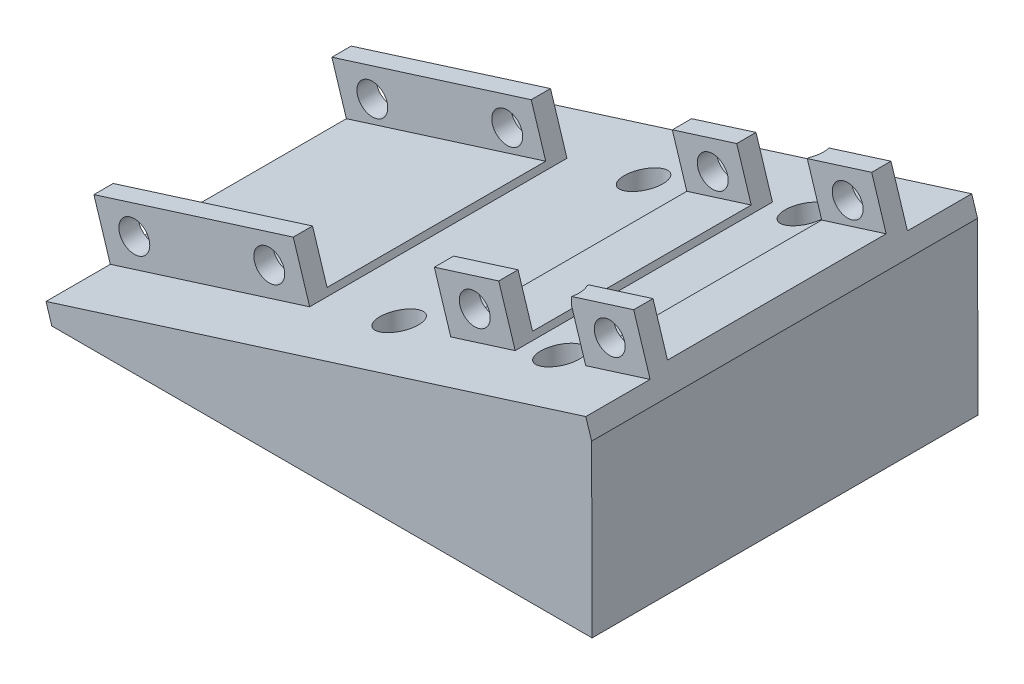
from build123d import *

# Parameters (mm, degrees)
EXTRUDE_1_DEPTH     = 60
SKETCH_2_W          = 32.5
SKETCH_2_H          = 3
EXTRUDE_2_DEPTH     = 8.5
SKETCH_3_W          = 32.5
SKETCH_3_H          = 34
EXTRUDE_3_DEPTH     = 1
SKETCH_4_R          = 2.4
CUT_EXTRUDE_1_DEPTH = 100
CUT_EXTRUDE_3_DEPTH = 100
SKETCH_5_R          = 1.62
CUT_EXTRUDE_4_DEPTH = 100
SKETCH_7_R          = 3
CUT_EXTRUDE_5_DEPTH = 100


with BuildPart() as part:
    # 草图1 → 凸台-拉伸1 (new body)
    with BuildSketch(Plane.XY):
        Polygon((-38.683076923, -5.470769231), (45.316923077, -5.470769231), (45.244014743, 20.991341126), (44.341897344, 23.852491978), (-39.585194322, -2.609618379), align=None)
    extrude(amount=EXTRUDE_1_DEPTH)

    # 草图2 → 凸台-拉伸2 (add)
    with BuildSketch(Plane(origin=(-2.83104293, 8.978921042, 0), x_dir=(0.9537169507482267, 0.30070579950427384, 0), z_dir=(-0.30070579950427384, 0.9537169507482267, 0))):
        with Locations((-22.287798204, -11.5)):
            Rectangle(SKETCH_2_W, SKETCH_2_H)
        with Locations((-22.287798204, -48.5)):
            Rectangle(SKETCH_2_W, SKETCH_2_H)
        with Locations((33.212201796, -11.5)):
            Rectangle(SKETCH_2_W, SKETCH_2_H)
        with Locations((33.212201796, -48.5)):
            Rectangle(SKETCH_2_W, SKETCH_2_H)
    extrude(amount=EXTRUDE_2_DEPTH)

    # 草图3 → 凸台-拉伸3 (add)
    with BuildSketch(Plane(origin=(-2.83104293, 8.978921042, 0), x_dir=(0.9537169507482267, 0.30070579950427384, 0), z_dir=(-0.30070579950427384, 0.9537169507482267, 0))):
        with Locations((-22.287798204, -30)):
            Rectangle(SKETCH_3_W, SKETCH_3_H)
        with Locations((33.212201796, -30)):
            Rectangle(SKETCH_3_W, SKETCH_3_H)
    extrude(amount=EXTRUDE_3_DEPTH)

    # 草图4 → 切除-拉伸1 (cut)
    with BuildSketch(Plane.XY.offset(50)):
        with Locations((-35.850165862, 3.003309771)):
            Circle(SKETCH_4_R)
        with Locations((-14.874407062, 9.637911699)):
            Circle(SKETCH_4_R)
        with Locations((17.075110788, 19.711555982)):
            Circle(SKETCH_4_R)
        with Locations((38.056883705, 26.327083571)):
            Circle(SKETCH_4_R)
    extrude(amount=-CUT_EXTRUDE_1_DEPTH, mode=Mode.SUBTRACT)

    # 草图6 → 切除-拉伸3 (cut)
    with BuildSketch(Plane(origin=(0, 0, 10), x_dir=(-1, 0, 0), z_dir=(0, 0, -1))):
        Polygon((-31.771870066, 28.801675164), (-34.327869361, 20.695081083), (-23.360124428, 17.236964389), (-20.804125132, 25.34355847), align=None)
    extrude(amount=-CUT_EXTRUDE_3_DEPTH, mode=Mode.SUBTRACT)

    # 草图5 → 切除-拉伸4 (cut)
    with BuildSketch(Plane(origin=(0, -5.470769231, 0), x_dir=(-1, 0, 0), z_dir=(0, -1, 0))):
        with Locations(Location((-29.316923077, -49, 0), (0, 0, 180))):
            Circle(SKETCH_5_R)
        with Locations(Location((-29.316923077, -11, 0), (0, 0, 180))):
            Circle(SKETCH_5_R)
        with Locations(Location((-4.316923077, -49, 0), (0, 0, 180))):
            Circle(SKETCH_5_R)
        with Locations(Location((-4.316923077, -11, 0), (0, 0, 180))):
            Circle(SKETCH_5_R)
    extrude(amount=-CUT_EXTRUDE_4_DEPTH, mode=Mode.SUBTRACT)

    # 草图7 → 切除-拉伸5 (cut)
    with BuildSketch(Plane(origin=(0, -2.470769231, 0), x_dir=(-1, 0, 0), z_dir=(0, -1, 0))):
        with Locations(Location((-29.316923077, -11, 0), (0, 0, 180))):
            Circle(SKETCH_7_R)
        with Locations(Location((-4.316923077, -11, 0), (0, 0, 180))):
            Circle(SKETCH_7_R)
        with Locations(Location((-29.316923077, -49, 0), (0, 0, 180))):
            Circle(SKETCH_7_R)
        with Locations(Location((-4.316923077, -49, 0), (0, 0, 180))):
            Circle(SKETCH_7_R)
    extrude(amount=-CUT_EXTRUDE_5_DEPTH, mode=Mode.SUBTRACT)


solid = part.part
